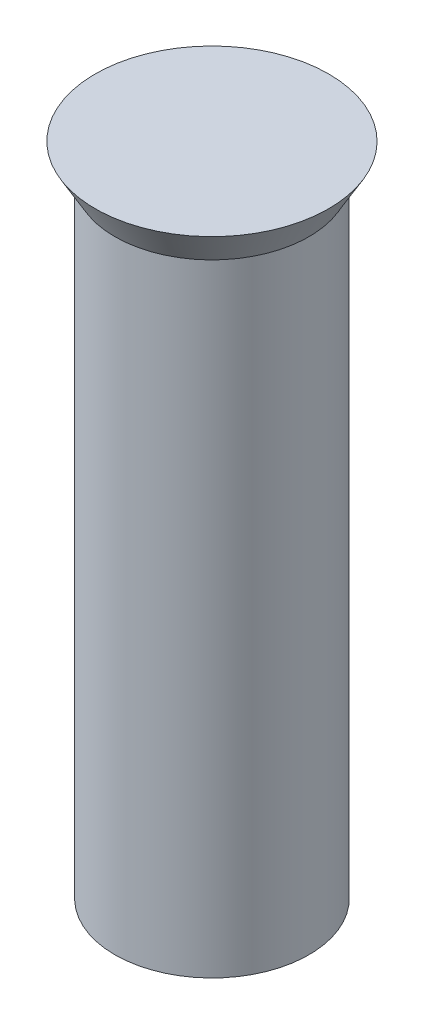
from build123d import *


with BuildPart() as part:
    # Sketch1 → Revolve1 (revolve)
    with BuildSketch(Plane.XY, mode=Mode.PRIVATE) as revolve1_sk:
        Polygon((0, 6.35), (1.1303, 6.35), (0.9398, 6.020044321), (0.9398, 0), (0, 0), align=None)
    revolve(revolve1_sk.sketch.rotate(Axis((0, 0, 0), (0, 1, 0)), 90), axis=Axis((0, 0, 0), (0, 1, 0)))


solid = part.part
